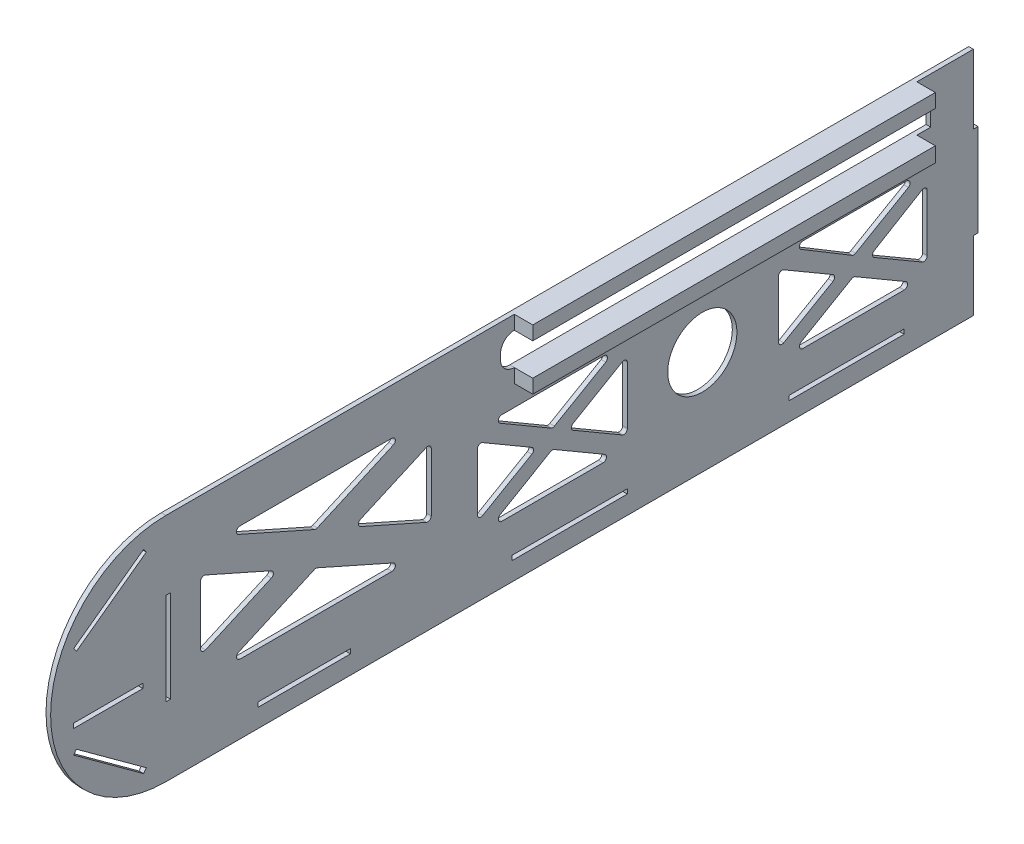
from build123d import *

# Parameters (mm, degrees)
SKETCH_1_W      = 2
SKETCH_1_H      = 40
SKETCH_1_W_2    = 40
SKETCH_1_H_2    = 2
SKETCH_1_W_3    = 50
SKETCH_1_R      = 15
SKETCH_1_W_4    = 30
EXTRUDE_3_DEPTH = 2
SKETCH_2_W      = 174.5
SKETCH_2_H      = 6
EXTRUDE_4_DEPTH = 10


with BuildPart() as part:
    # 草图1 → 凸台-拉伸3 (new body)
    with BuildSketch(Plane(origin=(0, 0, 0), x_dir=(0, 0, -1), z_dir=(1, 0, 0))):
        with BuildLine():
            Line((350, 50), (0, 50))
            ThreePointArc((0, 50), (-50, 0), (0, -50))
            Line((0, -50), (350, -50))
            Line((350, -50), (350, -20))
            Line((350, -20), (352, -20))
            Line((352, -20), (352, 20))
            Line((352, 20), (350, 20))
            Line((350, 20), (350, 50))
        make_face()
        with BuildLine():
            ThreePointArc((145, 38), (146.757359313, 42.242640687), (151, 44))
            Line((151, 44), (325.5, 44))
            ThreePointArc((325.5, 44), (329.742640687, 42.242640687), (331.5, 38))
            Line((331.5, 38), (331.5, 30))
            Line((331.5, 30), (151, 30))
            ThreePointArc((151, 30), (146.757359313, 31.757359313), (145, 36))
            Line((145, 36), (145, 38))
        make_face(mode=Mode.SUBTRACT)
        with Locations((1, 0)):
            Rectangle(SKETCH_1_W, SKETCH_1_H, mode=Mode.SUBTRACT)
        with Locations((60, -41)):
            Rectangle(SKETCH_1_W_2, SKETCH_1_H_2, mode=Mode.SUBTRACT)
        with BuildLine():
            Line((97.931678324, -20), (32.068321676, -20))
            ThreePointArc((32.068321676, -20), (30.600998265, -18.811387231), (31.459113977, -17.129282677))
            Line((31.459113977, -17.129282677), (64.390792301, -2.4929812))
            ThreePointArc((64.390792301, -2.4929812), (65, -2.363698523), (65.609207699, -2.4929812))
            Line((65.609207699, -2.4929812), (98.540886023, -17.129282677))
            ThreePointArc((98.540886023, -17.129282677), (99.399001735, -18.811387231), (97.931678324, -20))
        make_face(mode=Mode.SUBTRACT)
        with BuildLine():
            Line((135, -17.39868764), (135, 7.388444501))
            ThreePointArc((135, 7.388444501), (135.75290891, 8.68915773), (137.255806538, 8.684112853))
            Line((137.255806538, 8.684112853), (158.585016393, -3.757926229))
            ThreePointArc((158.585016393, -3.757926229), (159.329207689, -5.056143052), (158.580609404, -6.35182365))
            Line((158.580609404, -6.35182365), (137.25139955, -18.69691671))
            ThreePointArc((137.25139955, -18.69691671), (135.750700102, -18.698129698), (135, -17.39868764))
        make_face(mode=Mode.SUBTRACT)
        with Locations((175, -41)):
            Rectangle(SKETCH_1_W_3, SKETCH_1_H_2, mode=Mode.SUBTRACT)
        with Locations((295, -41)):
            Rectangle(SKETCH_1_W_3, SKETCH_1_H_2, mode=Mode.SUBTRACT)
        with BuildLine():
            Line((189.451619145, -25), (145.548380855, -25))
            ThreePointArc((145.548380855, -25), (144.100364535, -23.891469969), (144.792574317, -22.204331649))
            Line((144.792574317, -22.204331649), (166.744193462, -9.399220481))
            ThreePointArc((166.744193462, -9.399220481), (167.5, -9.194888832), (168.255806538, -9.399220481))
            Line((168.255806538, -9.399220481), (190.207425683, -22.204331649))
            ThreePointArc((190.207425683, -22.204331649), (190.899635465, -23.891469969), (189.451619145, -25))
        make_face(mode=Mode.SUBTRACT)
        with BuildLine():
            ThreePointArc((197.744193462, 8.684112853), (199.24709109, 8.68915773), (200, 7.388444501))
            Line((200, 7.388444501), (200, -17.388444501))
            ThreePointArc((200, -17.388444501), (199.24709109, -18.68915773), (197.744193462, -18.684112853))
            Line((197.744193462, -18.684112853), (176.506860031, -6.295668351))
            ThreePointArc((176.506860031, -6.295668351), (175.762666569, -5), (176.506860031, -3.704331649))
            Line((176.506860031, -3.704331649), (197.744193462, 8.684112853))
        make_face(mode=Mode.SUBTRACT)
        with Locations((232.5, -5)):
            Circle(SKETCH_1_R, mode=Mode.SUBTRACT)
        with BuildLine():
            Line((319.974166797, -25.394327939), (276.070928507, -25.394327939))
            ThreePointArc((276.070928507, -25.394327939), (274.622912187, -24.285797907), (275.315121969, -22.598659587))
            Line((275.315121969, -22.598659587), (297.266741114, -9.793548419))
            ThreePointArc((297.266741114, -9.793548419), (298.022547652, -9.589216771), (298.778354191, -9.793548419))
            Line((298.778354191, -9.793548419), (320.729973336, -22.598659587))
            ThreePointArc((320.729973336, -22.598659587), (321.422183118, -24.285797907), (319.974166797, -25.394327939))
        make_face(mode=Mode.SUBTRACT)
        with BuildLine():
            Line((265.522547652, -17.793015579), (265.522547652, 6.994116563))
            ThreePointArc((265.522547652, 6.994116563), (266.275456563, 8.294829792), (267.778354191, 8.289784914))
            Line((267.778354191, 8.289784914), (289.107564045, -4.152254168))
            ThreePointArc((289.107564045, -4.152254168), (289.851755342, -5.45047099), (289.103157056, -6.746151588))
            Line((289.103157056, -6.746151588), (267.773947202, -19.091244648))
            ThreePointArc((267.773947202, -19.091244648), (266.273247754, -19.092457637), (265.522547652, -17.793015579))
        make_face(mode=Mode.SUBTRACT)
        with BuildLine():
            ThreePointArc((327.730104505, 8.28146303), (329.239985391, 8.298885363), (330, 6.994116563))
            Line((330, 6.994116563), (330, -17.477952976))
            ThreePointArc((330, -17.477952976), (329.24709109, -18.778666205), (327.744193462, -18.773621327))
            Line((327.744193462, -18.773621327), (307.029407683, -6.68999629))
            ThreePointArc((307.029407683, -6.68999629), (306.285236534, -5.40250951), (307.015318726, -4.106981472))
            Line((307.015318726, -4.106981472), (327.730104505, 8.28146303))
        make_face(mode=Mode.SUBTRACT)
        with BuildLine():
            Line((15, -7.691857033), (15, 17.691857033))
            ThreePointArc((15, 17.691857033), (15.682629689, 18.94959539), (17.109207699, 19.062574356))
            Line((17.109207699, 19.062574356), (45.665886023, 6.370717323))
            ThreePointArc((45.665886023, 6.370717323), (46.556678324, 5), (45.665886023, 3.629282677))
            Line((45.665886023, 3.629282677), (17.109207699, -9.062574356))
            ThreePointArc((17.109207699, -9.062574356), (15.682629689, -8.94959539), (15, -7.691857033))
        make_face(mode=Mode.SUBTRACT)
        with BuildLine():
            Line((112.890792301, -9.062574356), (84.334113977, 3.629282677))
            ThreePointArc((84.334113977, 3.629282677), (83.443321676, 5), (84.334113977, 6.370717323))
            Line((84.334113977, 6.370717323), (112.890792301, 19.062574356))
            ThreePointArc((112.890792301, 19.062574356), (114.317370311, 18.94959539), (115, 17.691857033))
            Line((115, 17.691857033), (115, -7.691857033))
            ThreePointArc((115, -7.691857033), (114.317370311, -8.94959539), (112.890792301, -9.062574356))
        make_face(mode=Mode.SUBTRACT)
        with BuildLine():
            ThreePointArc((31.459113977, 27.129282677), (30.600998265, 28.811387231), (32.068321676, 30))
            Line((32.068321676, 30), (97.931678324, 30))
            ThreePointArc((97.931678324, 30), (99.399001735, 28.811387231), (98.540886023, 27.129282677))
            Line((98.540886023, 27.129282677), (65.609207699, 12.4929812))
            ThreePointArc((65.609207699, 12.4929812), (65, 12.363698523), (64.390792301, 12.4929812))
            Line((64.390792301, 12.4929812), (31.459113977, 27.129282677))
        make_face(mode=Mode.SUBTRACT)
        with BuildLine():
            ThreePointArc((144.792574317, 12.204331649), (144.100364535, 13.891469969), (145.548380855, 15))
            Line((145.548380855, 15), (189.885145799, 15))
            ThreePointArc((189.885145799, 15), (191.333825129, 13.889009252), (190.636545348, 12.20177093))
            Line((190.636545348, 12.20177093), (168.381459159, -0.679208343))
            ThreePointArc((168.381459159, -0.679208343), (167.627511138, -0.880977109), (166.874253072, -0.676647625))
            Line((166.874253072, -0.676647625), (144.792574317, 12.204331649))
        make_face(mode=Mode.SUBTRACT)
        with BuildLine():
            ThreePointArc((275.298059327, 12.21443661), (274.625531488, 13.901032988), (276.070928507, 15))
            Line((276.070928507, 15), (321.088992758, 15))
            ThreePointArc((321.088992758, 15), (322.537672089, 13.889009252), (321.840392308, 12.20177093))
            Line((321.840392308, 12.20177093), (298.904006812, -1.073536282))
            ThreePointArc((298.904006812, -1.073536282), (298.140143671, -1.275255431), (297.379738082, -1.060870603))
            Line((297.379738082, -1.060870603), (275.298059327, 12.21443661))
        make_face(mode=Mode.SUBTRACT)
        Polygon((-40, 20), (-9.698170842, 42.091834457), (-8.519939671, 40.475736902), (-38.821768829, 18.383902445), align=None, mode=Mode.SUBTRACT)
        with Locations((-25, -9)):
            Rectangle(SKETCH_1_W_4, SKETCH_1_H_2, mode=Mode.SUBTRACT)
        Polygon((-40, -20), (-38.821768829, -18.383902445), (-8.519939671, -40.475736902), (-9.698170842, -42.091834457), align=None, mode=Mode.SUBTRACT)
    extrude(amount=EXTRUDE_3_DEPTH)

    # 草图2 → 凸台-拉伸4 (add)
    with BuildSketch(Plane(origin=(0, 0, 0), x_dir=(0, 0, -1), z_dir=(1, 0, 0))):
        with Locations((238.25, 47)):
            Rectangle(SKETCH_2_W, SKETCH_2_H)
        Polygon((151, 30), (151, 24), (325.5, 23.560383637), (325.5, 30), align=None)
    extrude(amount=EXTRUDE_4_DEPTH)


solid = part.part
